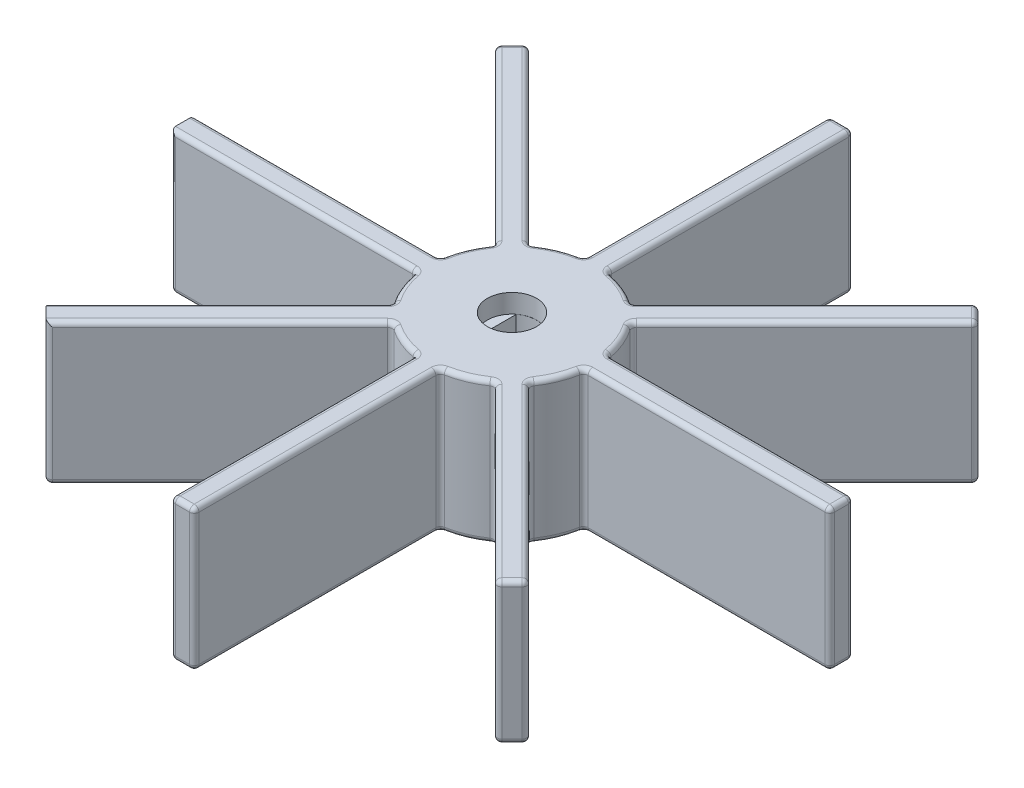
from build123d import *

# Parameters (mm, degrees)
SKETCH1_R           = 9
BOSS_EXTRUDE1_DEPTH = 15
SKETCH4_W           = 27
SKETCH4_H           = 2.5
BOSS_EXTRUDE2_DEPTH = 15
CIRPATTERN1_COUNT   = 8
SKETCH6_R           = 2.61
CUT_EXTRUDE2_DEPTH  = 2
FILLET1_R           = 0.5


with BuildPart() as part:
    # Sketch1 → Boss-Extrude1 (new body)
    with BuildSketch(Plane(origin=(0, 0, 0), x_dir=(1, 0, 0), z_dir=(0, 1, 0))):
        with Locations(Location((0, 0, 0), (0, 0, 270))):
            Circle(SKETCH1_R)
        with BuildLine():
            Line((1.6, -2.049390153), (1.6, 2.049390153))
            ThreePointArc((1.6, 2.049390153), (0, 2.6), (-1.6, 2.049390153))
            Line((-1.6, 2.049390153), (-1.6, -2.049390153))
            ThreePointArc((-1.6, -2.049390153), (0, -2.6), (1.6, -2.049390153))
        make_face(mode=Mode.SUBTRACT)
    extrude(amount=BOSS_EXTRUDE1_DEPTH)

    # Sketch4 → Boss-Extrude2 (add)
    with BuildSketch(Plane(origin=(0, 0, 0), x_dir=(1, 0, 0), z_dir=(0, 1, 0))):
        with Locations((21.5, 0)):
            Rectangle(SKETCH4_W, SKETCH4_H)
    boss_extrude2 = extrude(amount=BOSS_EXTRUDE2_DEPTH)

    # CirPattern1: Boss-Extrude2 ×8 about axis
    cirpattern1_axis = Axis((0, 0, 0), (0, 1, 0))
    for i in range(1, CIRPATTERN1_COUNT):
        add(boss_extrude2.rotate(cirpattern1_axis, i * 360 / CIRPATTERN1_COUNT))

    # Sketch6 → Cut-Extrude2 (cut)
    with BuildSketch(Plane(origin=(0, 15, 0), x_dir=(1, 0, 0), z_dir=(0, 1, 0))):
        with Locations(Location((0, 0, 0), (0, 0, 270))):
            Circle(SKETCH6_R)
    extrude(amount=-CUT_EXTRUDE2_DEPTH, mode=Mode.SUBTRACT)

    # Fillet1
    fillet1_edges = [part.edges().sort_by_distance(p)[0] for p in [
        (-35, 7.5, -1.25),
        (-35, 0, 0),
        (-21.956385867, 15, -1.25),
        (-21.956385867, 15, 1.25),
        (-3.444150891, 0, 8.314915793),
        (-3.444150891, 15, 8.314915793),
        (-7.186164809, 7.5, 5.418397856),
        (-16.409392814, 0, 14.641625861),
        (-14.641625861, 0, 16.409392814),
        (-5.418397856, 7.5, 7.186164809),
        (-23.864853865, 7.5, 25.632620818),
        (-25.632620818, 7.5, 23.864853865),
        (-24.748737342, 0, 24.748737342),
        (-16.409392814, 15, 14.641625861),
        (-14.641625861, 15, 16.409392814),
        (3.444150891, 0, 8.314915793),
        (3.444150891, 15, 8.314915793),
        (-1.25, 7.5, 8.912771735),
        (-1.25, 0, 21.956385867),
        (1.25, 0, 21.956385867),
        (1.25, 7.5, 8.912771735),
        (1.25, 7.5, 35),
        (-1.25, 7.5, 35),
        (0, 0, 35),
        (-1.25, 15, 21.956385867),
        (0, 15, 35),
        (1.25, 15, 21.956385867),
        (8.314915793, 0, 3.444150891),
        (8.314915793, 15, 3.444150891),
        (5.418397856, 7.5, 7.186164809),
        (14.641625861, 0, 16.409392814),
        (16.409392814, 0, 14.641625861),
        (7.186164809, 7.5, 5.418397856),
        (25.632620818, 7.5, 23.864853865),
        (23.864853865, 7.5, 25.632620818),
        (24.748737342, 0, 24.748737342),
        (14.641625861, 15, 16.409392814),
        (24.748737342, 15, 24.748737342),
        (16.409392814, 15, 14.641625861),
        (8.314915793, 15, -3.444150891),
        (8.314915793, 0, -3.444150891),
        (8.912771735, 7.5, -1.25),
        (8.912771735, 7.5, 1.25),
        (21.956385867, 0, 1.25),
        (21.956385867, 0, -1.25),
        (35, 7.5, -1.25),
        (35, 7.5, 1.25),
        (35, 0, 0),
        (21.956385867, 15, 1.25),
        (35, 15, 0),
        (21.956385867, 15, -1.25),
        (3.444150891, 0, -8.314915793),
        (3.444150891, 15, -8.314915793),
        (7.186164809, 7.5, -5.418397856),
        (16.409392814, 0, -14.641625861),
        (14.641625861, 0, -16.409392814),
        (5.418397856, 7.5, -7.186164809),
        (23.864853865, 7.5, -25.632620818),
        (25.632620818, 7.5, -23.864853865),
        (24.748737342, 0, -24.748737342),
        (16.409392814, 15, -14.641625861),
        (24.748737342, 15, -24.748737342),
        (14.641625861, 15, -16.409392814),
        (-3.444150891, 0, -8.314915793),
        (-3.444150891, 15, -8.314915793),
        (1.25, 7.5, -8.912771735),
        (1.25, 0, -21.956385867),
        (-1.25, 0, -21.956385867),
        (-1.25, 7.5, -8.912771735),
        (-1.25, 7.5, -35),
        (1.25, 7.5, -35),
        (0, 0, -35),
        (1.25, 15, -21.956385867),
        (0, 15, -35),
        (-1.25, 15, -21.956385867),
        (-8.314915793, 0, -3.444150891),
        (0, 0, 2.6),
        (-8.314915793, 15, -3.444150891),
        (-5.418397856, 7.5, -7.186164809),
        (-14.641625861, 0, -16.409392814),
        (-16.409392814, 0, -14.641625861),
        (1.6, 0, 0),
        (-7.186164809, 7.5, -5.418397856),
        (-25.632620818, 7.5, -23.864853865),
        (-23.864853865, 7.5, -25.632620818),
        (-24.748737342, 0, -24.748737342),
        (-14.641625861, 15, -16.409392814),
        (-24.748737342, 15, -24.748737342),
        (-16.409392814, 15, -14.641625861),
        (0, 0, -2.6),
        (-1.6, 0, 0),
        (-8.314915793, 0, 3.444150891),
        (-8.314915793, 15, 3.444150891),
        (-8.912771735, 7.5, -1.25),
        (-21.956385867, 0, -1.25),
        (-21.956385867, 0, 1.25),
        (-8.912771735, 7.5, 1.25),
        (-35, 7.5, 1.25),
    ]]
    fillet(fillet1_edges, radius=FILLET1_R)


solid = part.part
